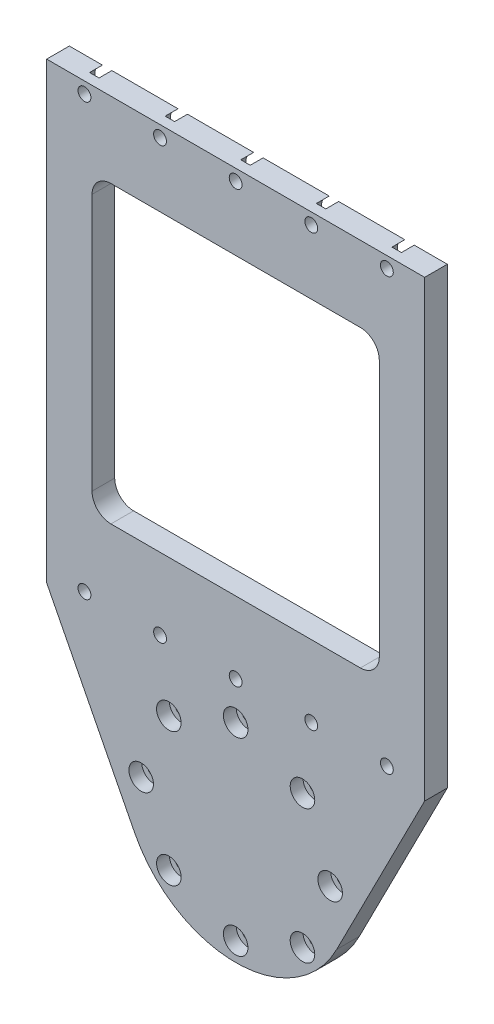
from build123d import *

# Parameters (mm, degrees)
BOSS_EXTRUDE1_DEPTH                                 = 6
BOSS_EXTRUDE2_START                                 = -6
BOSS_EXTRUDE2_DEPTH                                 = 6
CBORE_FOR_M3_HEX_SOCKET_HEAD_CAP_SCREW1_D           = 3.4
CBORE_FOR_M3_HEX_SOCKET_HEAD_CAP_SCREW1_CBORE_D     = 6.5
CBORE_FOR_M3_HEX_SOCKET_HEAD_CAP_SCREW1_CBORE_DEPTH = 3.4
CBORE_FOR_M3_HEX_SOCKET_HEAD_CAP_SCREW2_D           = 3.4
CBORE_FOR_M3_HEX_SOCKET_HEAD_CAP_SCREW2_DEPTH       = 10
CBORE_FOR_M3_HEX_SOCKET_HEAD_CAP_SCREW2_CBORE_D     = 6.5
CBORE_FOR_M3_HEX_SOCKET_HEAD_CAP_SCREW2_CBORE_DEPTH = 3.4
CBORE_FOR_M3_HEX_SOCKET_HEAD_CAP_SCREW2_TIP         = 1.021463052
CUT_EXTRUDE1_REACH                                  = 162.125
SKETCH8_W                                           = 76
SKETCH8_H                                           = 78
CUT_EXTRUDE1_DIRECTION_2_DEPTH                      = 161.12495121
FILLET2_R                                           = 5


with BuildPart() as part:
    # Sketch1 → Boss-Extrude1 (new body)
    with BuildSketch(Plane.XY):
        with BuildLine():
            Line((-30, 0), (-30, 152))
            Line((-30, 152), (30, 152))
            Line((30, 152), (30, 0))
            ThreePointArc((30, 0), (0, -30), (-30, 0))
        make_face()
    extrude(amount=BOSS_EXTRUDE1_DEPTH)

    # Sketch7 → Boss-Extrude2 (add)
    with BuildSketch(Plane.XY.offset(6).offset(BOSS_EXTRUDE2_START)):
        with BuildLine():
            Line((-50, 152), (-50, 32))
            Line((-50, 32), (-26.72417541, -13.631524078))
            ThreePointArc((-26.72417541, -13.631524078), (-29.169549725, -7.009805194), (-30, 0))
            Line((-30, 0), (-30, 32))
            Line((-30, 32), (-30, 152))
            Line((-30, 152), (-50, 152))
        make_face()
        with BuildLine():
            ThreePointArc((30, 0), (29.169549725, -7.009805194), (26.72417541, -13.631524078))
            Line((26.72417541, -13.631524078), (50, 32))
            Line((50, 32), (50, 152))
            Line((50, 152), (30, 152))
            Line((30, 152), (30, 32))
            Line((30, 32), (30, 0))
        make_face()
    extrude(amount=BOSS_EXTRUDE2_DEPTH)

    # CBORE for M3 Hex Socket Head Cap Screw1 (through all)
    with Locations(Plane.XY.offset(6)):
        with Locations((-17.67766953, 17.67766953), (0, 25), (17.67766953, 17.67766953), (25, 0), (17.67766953, -17.67766953), (0, -25), (-17.67766953, -17.67766953), (-25, 0)):
            CounterBoreHole(CBORE_FOR_M3_HEX_SOCKET_HEAD_CAP_SCREW1_D / 2, CBORE_FOR_M3_HEX_SOCKET_HEAD_CAP_SCREW1_CBORE_D / 2, CBORE_FOR_M3_HEX_SOCKET_HEAD_CAP_SCREW1_CBORE_DEPTH)

    # CBORE for M3 Hex Socket Head Cap Screw2
    with Locations(Plane(origin=(0, 0, 0), x_dir=(-1, 0, 0), z_dir=(0, 0, -1))):
        with Locations((-40, 149), (0, 35), (20, 35), (40, 35), (-20, 35), (-40, 35), (0, 149), (20, 149), (40, 149), (-20, 149)):
            CounterBoreHole(CBORE_FOR_M3_HEX_SOCKET_HEAD_CAP_SCREW2_D / 2, CBORE_FOR_M3_HEX_SOCKET_HEAD_CAP_SCREW2_CBORE_D / 2, CBORE_FOR_M3_HEX_SOCKET_HEAD_CAP_SCREW2_CBORE_DEPTH, depth=CBORE_FOR_M3_HEX_SOCKET_HEAD_CAP_SCREW2_DEPTH)
            with Locations((0, 0, -(CBORE_FOR_M3_HEX_SOCKET_HEAD_CAP_SCREW2_DEPTH + CBORE_FOR_M3_HEX_SOCKET_HEAD_CAP_SCREW2_TIP / 2))):  # 118° drill point
                Cone(0, CBORE_FOR_M3_HEX_SOCKET_HEAD_CAP_SCREW2_D / 2, CBORE_FOR_M3_HEX_SOCKET_HEAD_CAP_SCREW2_TIP, mode=Mode.SUBTRACT)

    # Sketch8 → Cut-Extrude1 (cut, up to next)
    with BuildSketch(Plane(origin=(0, 0, 0), x_dir=(-1, 0, 0), z_dir=(0, 0, -1)), mode=Mode.PRIVATE) as cut_extrude1_sk1:
        with Locations((0, 93)):
            Rectangle(SKETCH8_W, SKETCH8_H)
    cut_extrude1_tool1 = extrude(cut_extrude1_sk1.sketch, amount=-CUT_EXTRUDE1_REACH, mode=Mode.PRIVATE) & part.part
    add(cut_extrude1_tool1.solids().sort_by_distance((0, 93, 0))[0], mode=Mode.SUBTRACT)

    # Sketch8 → Cut-Extrude1 direction 2 (cut)
    with BuildSketch(Plane(origin=(0, 0, 0), x_dir=(-1, 0, 0), z_dir=(0, 0, -1))):
        with Locations((0, 93)):
            Rectangle(SKETCH8_W, SKETCH8_H)
    extrude(amount=CUT_EXTRUDE1_DIRECTION_2_DEPTH, mode=Mode.SUBTRACT)

    # Fillet2
    fillet2_edges = [part.edges().sort_by_distance(p)[0] for p in [
        (38, 132, 3),
        (38, 54, 3),
        (-38, 54, 3),
        (-38, 132, 3),
    ]]
    fillet(fillet2_edges, radius=FILLET2_R)


solid = part.part
